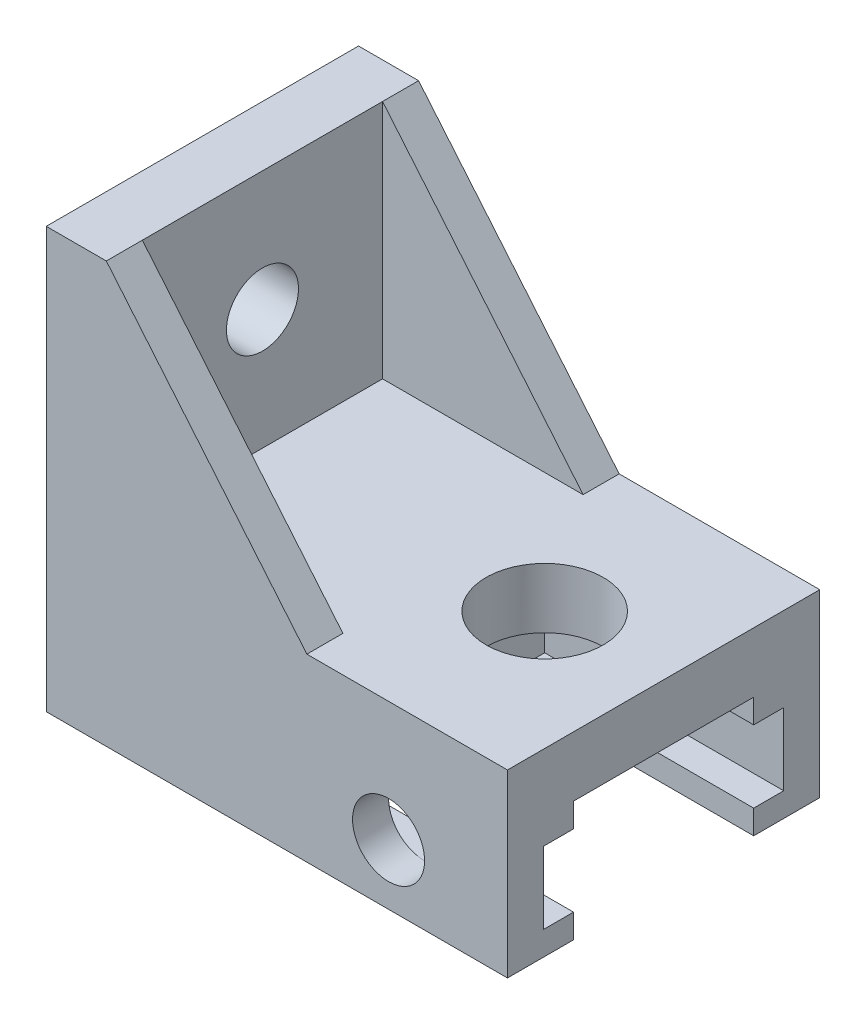
from build123d import *

# Parameters (mm, degrees)
SKETCH1_W           = 27
SKETCH1_H           = 26
BOSS_EXTRUDE1_DEPTH = 15
CUT_EXTRUDE2_DEPTH  = 23.5
SKETCH5_W           = 3.601284645
SKETCH5_H           = 15
CUT_EXTRUDE3_DEPTH  = 33.912763482
SKETCH6_R           = 3
CUT_EXTRUDE4_DEPTH  = 33.912763482
SKETCH11_R          = 4.875
CUT_EXTRUDE6_DEPTH  = 25.005207768
SKETCH13_W          = 26
SKETCH13_H          = 15
BOSS_EXTRUDE3_DEPTH = 15
SKETCH14_W          = 5
SKETCH14_H          = 26
BOSS_EXTRUDE4_DEPTH = 20
SKETCH15_R          = 3
CUT_EXTRUDE7_DEPTH  = 20
BOSS_EXTRUDE5_DEPTH = 3
BOSS_EXTRUDE6_DEPTH = 3


with BuildPart() as part:
    # Sketch1 → Boss-Extrude1 (new body)
    with BuildSketch(Plane(origin=(0, 0, 0), x_dir=(1, 0, 0), z_dir=(0, 1, 0))):
        Rectangle(SKETCH1_W, SKETCH1_H)
    extrude(amount=BOSS_EXTRUDE1_DEPTH)

    # Sketch4 → Cut-Extrude2 (cut)
    with BuildSketch(Plane(origin=(13.5, 0, 0), x_dir=(0, 0, -1), z_dir=(1, 0, 0))):
        Polygon((-10, 2), (-7.5, 2), (-7.5, 0), (7.5, 0), (7.5, 2), (10, 2), (10, 8), (7.5, 8), (7.5, 10), (-7.5, 10), (-7.5, 8), (-10, 8), align=None)
    extrude(amount=-CUT_EXTRUDE2_DEPTH, mode=Mode.SUBTRACT)

    # Sketch5 → Cut-Extrude3 (cut, through all)
    with BuildSketch(Plane(origin=(0, 0, -13), x_dir=(-1, 0, 0), z_dir=(0, 0, -1))):
        with Locations((-11.699357678, 7.5)):
            Rectangle(SKETCH5_W, SKETCH5_H)
    extrude(amount=-CUT_EXTRUDE3_DEPTH, mode=Mode.SUBTRACT)

    # Sketch6 → Cut-Extrude4 (cut, through all)
    with BuildSketch(Plane(origin=(0, 0, -13), x_dir=(-1, 0, 0), z_dir=(0, 0, -1))):
        with Locations((0, 5)):
            Circle(SKETCH6_R)
    extrude(amount=-CUT_EXTRUDE4_DEPTH, mode=Mode.SUBTRACT)

    # Sketch11 → Cut-Extrude6 (cut, through all)
    with BuildSketch(Plane(origin=(0, 15, 0), x_dir=(1, 0, 0), z_dir=(0, 1, 0))):
        with Locations(Location((0, 0, 0), (0, 0, 270))):
            Circle(SKETCH11_R)
    extrude(amount=-CUT_EXTRUDE6_DEPTH, mode=Mode.SUBTRACT)

    # Sketch13 → Boss-Extrude3 (add)
    with BuildSketch(Plane.ZY.offset(13.5)):
        with Locations((0, 7.5)):
            Rectangle(SKETCH13_W, SKETCH13_H)
    extrude(amount=BOSS_EXTRUDE3_DEPTH)

    # Sketch14 → Boss-Extrude4 (add)
    with BuildSketch(Plane(origin=(0, 15, 0), x_dir=(1, 0, 0), z_dir=(0, 1, 0))):
        with Locations((-26, 0)):
            Rectangle(SKETCH14_W, SKETCH14_H)
    extrude(amount=BOSS_EXTRUDE4_DEPTH)

    # Sketch15 → Cut-Extrude7 (cut)
    with BuildSketch(Plane(origin=(-23.5, 0, 0), x_dir=(0, 0, -1), z_dir=(1, 0, 0))):
        with Locations((0, 25)):
            Circle(SKETCH15_R)
    extrude(amount=-CUT_EXTRUDE7_DEPTH, mode=Mode.SUBTRACT)

    # Sketch16 → Boss-Extrude5 (add)
    with BuildSketch(Plane(origin=(0, 0, -13), x_dir=(-1, 0, 0), z_dir=(0, 0, -1))):
        Polygon((23.5, 35), (6.800642322, 15), (23.5, 15), align=None)
    extrude(amount=-BOSS_EXTRUDE5_DEPTH)

    # Sketch17 → Boss-Extrude6 (add)
    with BuildSketch(Plane.XY.offset(13)):
        Polygon((-23.5, 35), (-6.800642322, 15), (-23.5, 15), align=None)
    extrude(amount=-BOSS_EXTRUDE6_DEPTH)


solid = part.part
